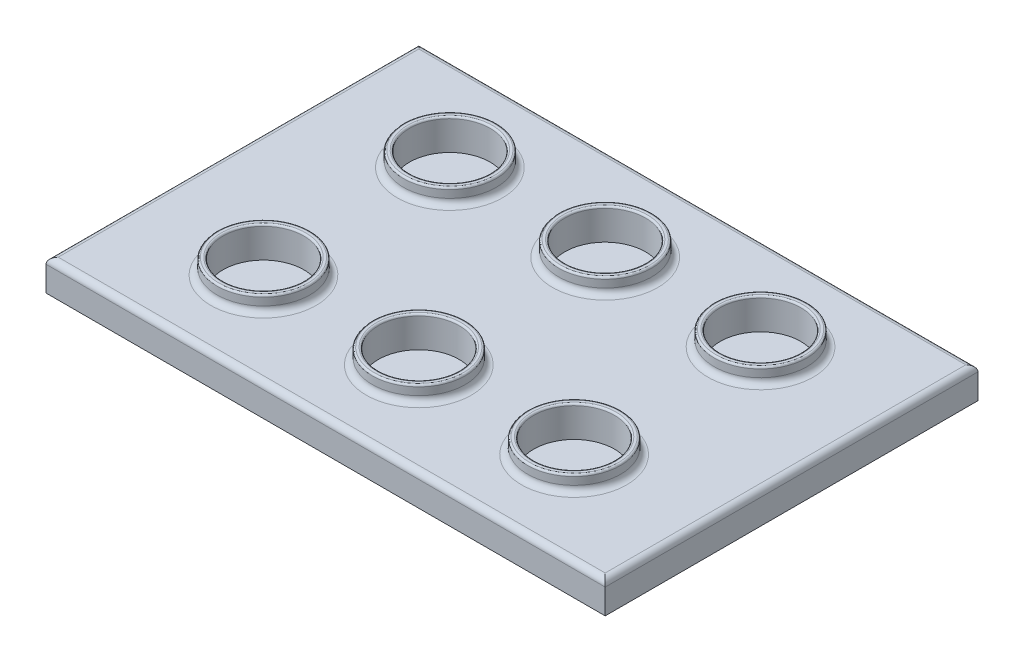
from build123d import *

# Parameters (mm, degrees)
SKETCH1_W           = 228.6
SKETCH1_H           = 152.4
BOSS_EXTRUDE1_DEPTH = 12.7
SKETCH2_R           = 16.51
CUT_EXTRUDE1_DEPTH  = 6.35
BOSS_EXTRUDE2_START = 6.35
SKETCH3_R           = 19.01
SKETCH3_R_2         = 16.51
BOSS_EXTRUDE2_DEPTH = 6.35
FILLET1_R           = 0.75
FILLET2_R           = 2.5


with BuildPart() as part:
    # Sketch1 → Boss-Extrude1 (new body)
    with BuildSketch(Plane(origin=(0, 0, 0), x_dir=(1, 0, 0), z_dir=(0, 1, 0))):
        Rectangle(SKETCH1_W, SKETCH1_H)
    extrude(amount=BOSS_EXTRUDE1_DEPTH)

    # Sketch2 → Cut-Extrude1 (cut)
    with BuildSketch(Plane(origin=(0, 12.7, 0), x_dir=(1, 0, 0), z_dir=(0, 1, 0))):
        with Locations(Location((-63.5, -38.1, 0), (0, 0, 270))):
            Circle(SKETCH2_R)
        with Locations(Location((0, -38.1, 0), (0, 0, 270))):
            Circle(SKETCH2_R)
        with Locations(Location((63.5, -38.1, 0), (0, 0, 270))):
            Circle(SKETCH2_R)
        with Locations(Location((0, 38.1, 0), (0, 0, 270))):
            Circle(SKETCH2_R)
        with Locations(Location((63.5, 38.1, 0), (0, 0, 270))):
            Circle(SKETCH2_R)
        with Locations(Location((-63.5, 38.1, 0), (0, 0, 270))):
            Circle(SKETCH2_R)
    extrude(amount=-CUT_EXTRUDE1_DEPTH, mode=Mode.SUBTRACT)

    # Sketch3 → Boss-Extrude2 (add)
    # profile 1 of 6: a face of its own
    with BuildSketch(Plane(origin=(0, 12.7, 0), x_dir=(1, 0, 0), z_dir=(0, 1, 0)).offset(BOSS_EXTRUDE2_START)):
        with Locations(Location((-63.5, 38.1, 0), (0, 0, 90))):
            Circle(SKETCH3_R)
        with Locations(Location((-63.5, 38.1, 0), (0, 0, 270))):
            Circle(SKETCH3_R_2, mode=Mode.SUBTRACT)
    # profile 2 of 6: a face of its own
    with BuildSketch(Plane(origin=(0, 12.7, 0), x_dir=(1, 0, 0), z_dir=(0, 1, 0)).offset(BOSS_EXTRUDE2_START)):
        with Locations(Location((0, 38.1, 0), (0, 0, 90))):
            Circle(SKETCH3_R)
        with Locations(Location((0, 38.1, 0), (0, 0, 270))):
            Circle(SKETCH3_R_2, mode=Mode.SUBTRACT)
    # profile 3 of 6: a face of its own
    with BuildSketch(Plane(origin=(0, 12.7, 0), x_dir=(1, 0, 0), z_dir=(0, 1, 0)).offset(BOSS_EXTRUDE2_START)):
        with Locations(Location((63.5, 38.1, 0), (0, 0, 90))):
            Circle(SKETCH3_R)
        with Locations(Location((63.5, 38.1, 0), (0, 0, 270))):
            Circle(SKETCH3_R_2, mode=Mode.SUBTRACT)
    # profile 4 of 6: a face of its own
    with BuildSketch(Plane(origin=(0, 12.7, 0), x_dir=(1, 0, 0), z_dir=(0, 1, 0)).offset(BOSS_EXTRUDE2_START)):
        with Locations(Location((63.5, -38.1, 0), (0, 0, 90))):
            Circle(SKETCH3_R)
        with Locations(Location((63.5, -38.1, 0), (0, 0, 270))):
            Circle(SKETCH3_R_2, mode=Mode.SUBTRACT)
    # profile 5 of 6: a face of its own
    with BuildSketch(Plane(origin=(0, 12.7, 0), x_dir=(1, 0, 0), z_dir=(0, 1, 0)).offset(BOSS_EXTRUDE2_START)):
        with Locations(Location((0, -38.1, 0), (0, 0, 90))):
            Circle(SKETCH3_R)
        with Locations(Location((0, -38.1, 0), (0, 0, 270))):
            Circle(SKETCH3_R_2, mode=Mode.SUBTRACT)
    # profile 6 of 6: a face of its own
    with BuildSketch(Plane(origin=(0, 12.7, 0), x_dir=(1, 0, 0), z_dir=(0, 1, 0)).offset(BOSS_EXTRUDE2_START)):
        with Locations(Location((-63.5, -38.1, 0), (0, 0, 90))):
            Circle(SKETCH3_R)
        with Locations(Location((-63.5, -38.1, 0), (0, 0, 270))):
            Circle(SKETCH3_R_2, mode=Mode.SUBTRACT)
    extrude(amount=-BOSS_EXTRUDE2_DEPTH)

    # Fillet1
    fillet1_edges = [part.edges().sort_by_distance(p)[0] for p in [
        (-63.5, 19.05, 57.11),
        (-63.5, 19.05, 21.59),
        (0, 19.05, 57.11),
        (0, 19.05, 21.59),
        (63.5, 19.05, 57.11),
        (63.5, 19.05, 21.59),
        (63.5, 19.05, -19.09),
        (63.5, 19.05, -54.61),
        (0, 19.05, -19.09),
        (0, 19.05, -54.61),
        (-63.5, 19.05, -19.09),
        (-63.5, 19.05, -54.61),
    ]]
    fillet(fillet1_edges, radius=FILLET1_R)

    # Fillet2
    fillet2_edges = [part.edges().sort_by_distance(p)[0] for p in [
        (-114.3, 12.7, 0),
        (0, 12.7, 76.2),
        (-63.5, 12.7, -19.09),
        (0, 12.7, -19.09),
        (63.5, 12.7, -19.09),
        (63.5, 12.7, 57.11),
        (0, 12.7, 57.11),
        (-63.5, 12.7, 57.11),
        (114.3, 12.7, 0),
        (0, 12.7, -76.2),
    ]]
    fillet(fillet2_edges, radius=FILLET2_R)


solid = part.part
